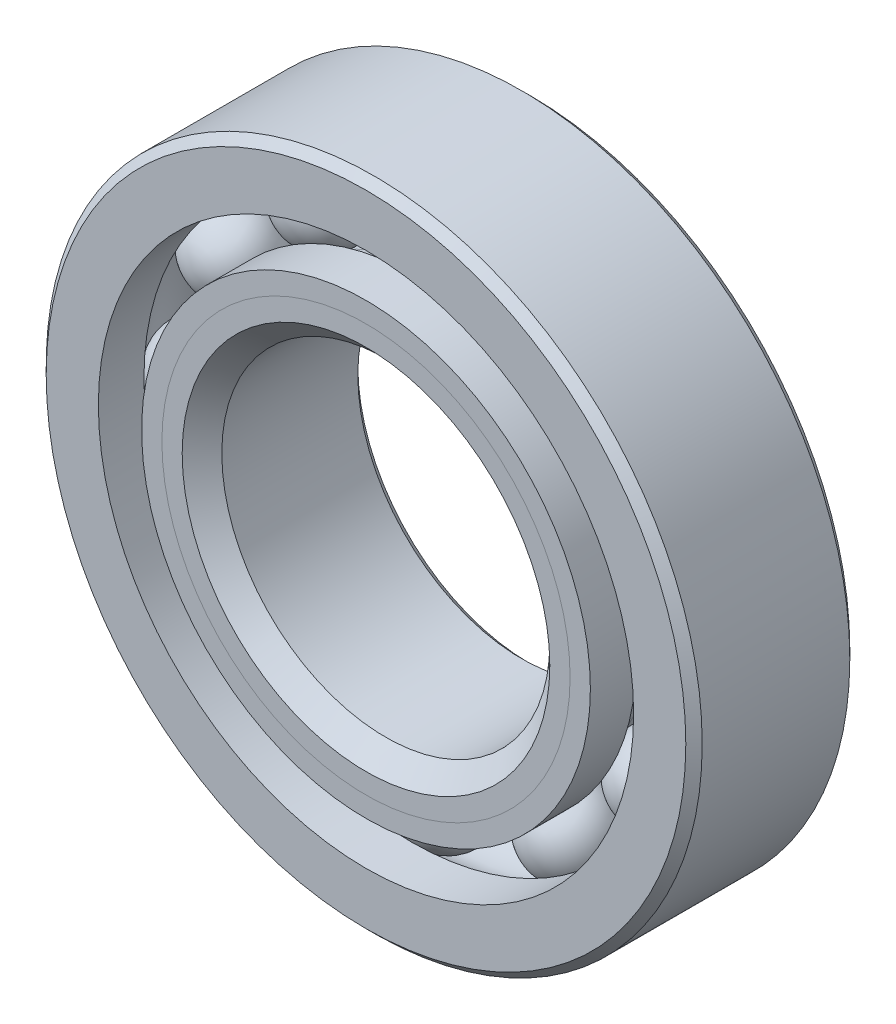
from build123d import *

# Parameters (mm, degrees)
CIRPATTERN1_COUNT = 12


with BuildPart() as part:
    # Sketch1 → Revolve1 (revolve)
    with BuildSketch(Plane(origin=(0, 0, 0), x_dir=(0, 0, -1), z_dir=(1, 0, 0))):
        with BuildLine():
            Line((1.42875, 6.35), (-1.42875, 6.35))
            Line((-1.42875, 6.35), (-1.5875, 6.19125))
            Line((-1.5875, 6.19125), (-1.5875, 5.181181319))
            Line((-1.5875, 5.181181319), (-0.705555556, 5.181181319))
            ThreePointArc((-0.705555556, 5.181181319), (0, 5.582928357), (0.705555556, 5.181181319))
            Line((0.705555556, 5.181181319), (1.5875, 5.181181319))
            Line((1.5875, 5.181181319), (1.5875, 6.19125))
            Line((1.5875, 6.19125), (1.42875, 6.35))
        make_face()
    revolve(axis=Axis((0, 0, 1.5875), (0, 0, -1)))


with BuildPart() as body_2:
    # Sketch2 → Revolve2 (revolve)
    with BuildSketch(Plane(origin=(0, 0, 0), x_dir=(0, 0, -1), z_dir=(1, 0, 0))):
        with BuildLine():
            Line((-1.5875, 4.343818681), (-0.705555556, 4.343818681))
            ThreePointArc((-0.705555556, 4.343818681), (-0.405958534, 4.049548138), (0, 3.942071643))
            Line((0, 3.942071643), (0, 3.558535822))
            Line((0, 3.558535822), (-1.19485857, 3.558535822))
            Line((-1.19485857, 3.558535822), (-1.5875, 3.951177251))
            Line((-1.5875, 3.951177251), (-1.5875, 4.343818681))
        make_face()
    revolve(axis=Axis((0, 0, 1.5875), (0, 0, -1)))


with BuildPart() as body_3:
    # Sketch3 → Revolve3 (revolve)
    with BuildSketch(Plane(origin=(0, 0, 0), x_dir=(0, 0, -1), z_dir=(1, 0, 0))):
        with BuildLine():
            Line((-1.5875, 3.951177251), (-1.19485857, 3.558535822))
            Line((-1.19485857, 3.558535822), (0, 3.558535822))
            Line((0, 3.558535822), (0, 3.942071643))
            ThreePointArc((0, 3.942071643), (0.405958534, 4.049548138), (0.705555556, 4.343818681))
            Line((0.705555556, 4.343818681), (1.5875, 4.343818681))
            Line((1.5875, 4.343818681), (1.5875, 3.33375))
            Line((1.5875, 3.33375), (1.42875, 3.175))
            Line((1.42875, 3.175), (-1.203964178, 3.175))
            Line((-1.203964178, 3.175), (-1.5875, 3.558535822))
            Line((-1.5875, 3.558535822), (-1.5875, 3.951177251))
        make_face()
    revolve(axis=Axis((0, 0, 1.5875), (0, 0, -1)))


with BuildPart() as body_4:
    # Sketch4 → Revolve4 (revolve)
    with BuildSketch(Plane(origin=(0, 0, 0), x_dir=(0, 0, -1), z_dir=(1, 0, 0))):
        with BuildLine():
            Line((-0.820428357, 4.7625), (0.820428357, 4.7625))
            ThreePointArc((0.820428357, 4.7625), (0, 5.582928357), (-0.820428357, 4.7625))
        make_face()
    revolve(axis=Axis((0, 4.7625, 0.820428357), (0, 0, -1)))


with BuildPart() as cirpattern1_1:
    # CirPattern1: pattern copy
    add(body_4.part.rotate(Axis((0, 0, -1.5875), (0, 0, 1)), 1 * 360 / CIRPATTERN1_COUNT))


with BuildPart() as cirpattern1_2:
    # CirPattern1: pattern copy
    add(body_4.part.rotate(Axis((0, 0, -1.5875), (0, 0, 1)), 2 * 360 / CIRPATTERN1_COUNT))


with BuildPart() as cirpattern1_3:
    # CirPattern1: pattern copy
    add(body_4.part.rotate(Axis((0, 0, -1.5875), (0, 0, 1)), 3 * 360 / CIRPATTERN1_COUNT))


with BuildPart() as cirpattern1_4:
    # CirPattern1: pattern copy
    add(body_4.part.rotate(Axis((0, 0, -1.5875), (0, 0, 1)), 4 * 360 / CIRPATTERN1_COUNT))


with BuildPart() as cirpattern1_5:
    # CirPattern1: pattern copy
    add(body_4.part.rotate(Axis((0, 0, -1.5875), (0, 0, 1)), 5 * 360 / CIRPATTERN1_COUNT))


with BuildPart() as cirpattern1_6:
    # CirPattern1: pattern copy
    add(body_4.part.rotate(Axis((0, 0, -1.5875), (0, 0, 1)), 6 * 360 / CIRPATTERN1_COUNT))


with BuildPart() as cirpattern1_7:
    # CirPattern1: pattern copy
    add(body_4.part.rotate(Axis((0, 0, -1.5875), (0, 0, 1)), 7 * 360 / CIRPATTERN1_COUNT))


with BuildPart() as cirpattern1_8:
    # CirPattern1: pattern copy
    add(body_4.part.rotate(Axis((0, 0, -1.5875), (0, 0, 1)), 8 * 360 / CIRPATTERN1_COUNT))


with BuildPart() as cirpattern1_9:
    # CirPattern1: pattern copy
    add(body_4.part.rotate(Axis((0, 0, -1.5875), (0, 0, 1)), 9 * 360 / CIRPATTERN1_COUNT))


with BuildPart() as cirpattern1_10:
    # CirPattern1: pattern copy
    add(body_4.part.rotate(Axis((0, 0, -1.5875), (0, 0, 1)), 10 * 360 / CIRPATTERN1_COUNT))


with BuildPart() as cirpattern1_11:
    # CirPattern1: pattern copy
    add(body_4.part.rotate(Axis((0, 0, -1.5875), (0, 0, 1)), 11 * 360 / CIRPATTERN1_COUNT))


solid = Compound([part.part, body_2.part, body_3.part, body_4.part, cirpattern1_1.part, cirpattern1_2.part, cirpattern1_3.part, cirpattern1_4.part, cirpattern1_5.part, cirpattern1_6.part, cirpattern1_7.part, cirpattern1_8.part, cirpattern1_9.part, cirpattern1_10.part, cirpattern1_11.part])
